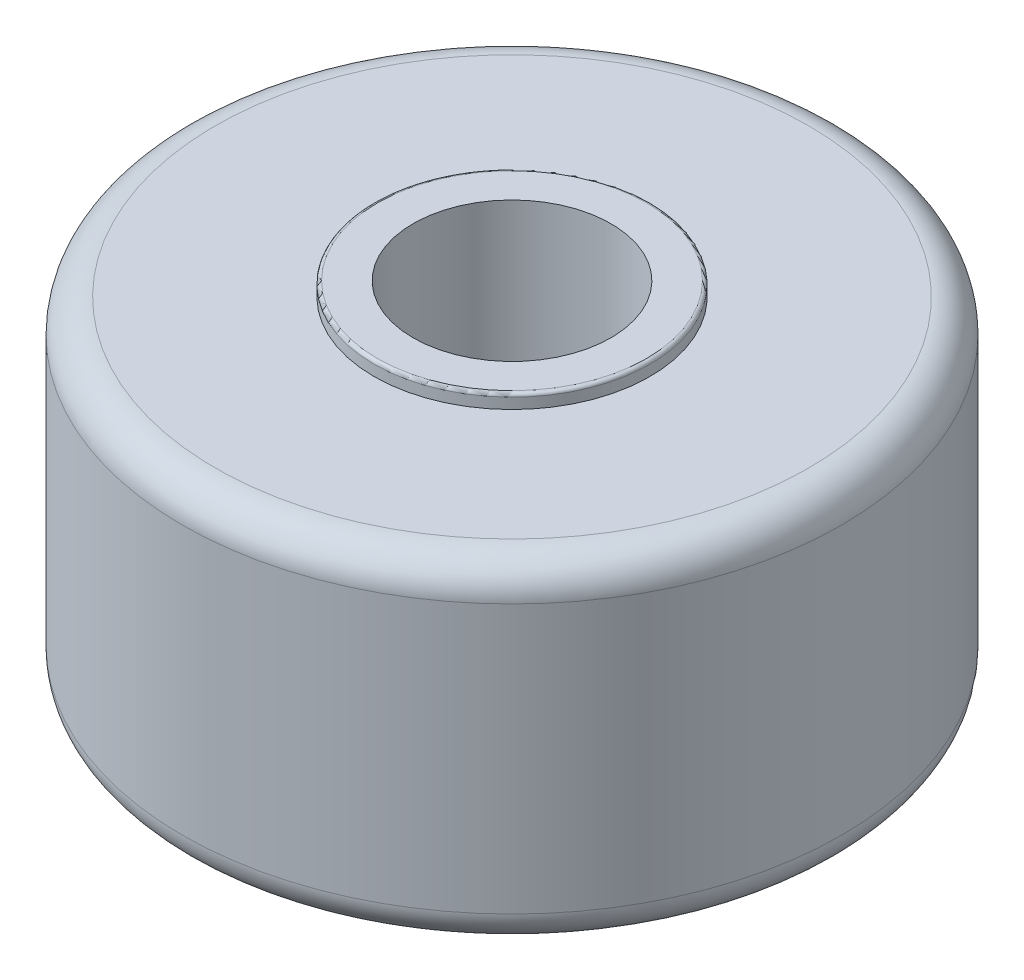
from build123d import *

# Parameters (mm, degrees)
FILLET1_R = 5.08
FILLET2_R = 0.508


with BuildPart() as part:
    # Sketch1 → Revolve1 (revolve)
    with BuildSketch(Plane(origin=(0, 0, 0), x_dir=(0, 0, -1), z_dir=(1, 0, 0)), mode=Mode.PRIVATE) as revolve1_sk:
        Polygon((21.2725, -25.781), (21.2725, -27.94), (15.2527, -27.94), (15.2527, 27.94), (21.2725, 27.94), (21.2725, 25.781), (50.8, 25.781), (50.8, -25.781), align=None)
    revolve(revolve1_sk.sketch.rotate(Axis((0, 25.781, 0), (0, -1, 0)), 180), axis=Axis((0, 25.781, 0), (0, -1, 0)))

    # Fillet1
    fillet1_edges = [part.edges().sort_by_distance(p)[0] for p in [
        (0, -25.781, -50.8),
        (0, 25.781, -50.8),
    ]]
    fillet(fillet1_edges, radius=FILLET1_R)

    # Fillet2
    fillet2_edges = [part.edges().sort_by_distance(p)[0] for p in [
        (0, -27.94, -21.2725),
        (0, 27.94, -21.2725),
    ]]
    fillet(fillet2_edges, radius=FILLET2_R)


solid = part.part
